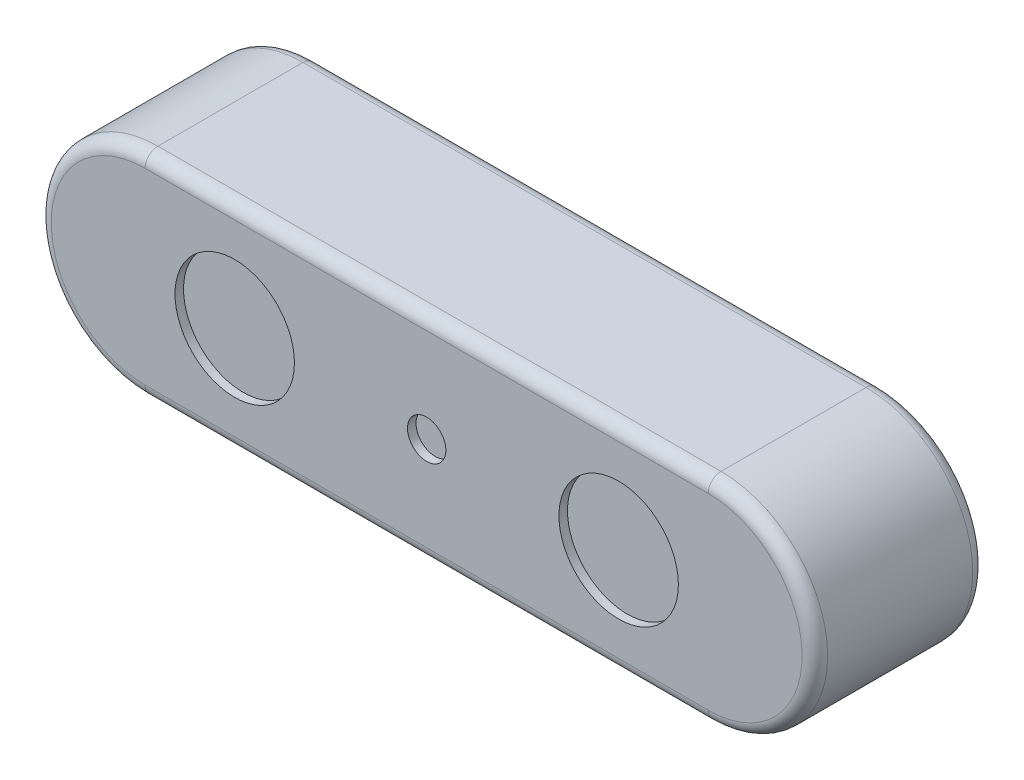
from build123d import *

# Parameters (mm, degrees)
BOSS_EXTRUDE1_DEPTH = 20
FILLET1_R           = 1.5
SKETCH2_R           = 7
SKETCH2_R_2         = 2.25
CUT_EXTRUDE1_DEPTH  = 1
SKETCH3_R           = 1.5
CUT_EXTRUDE2_DEPTH  = 3


with BuildPart() as part:
    # Sketch1 → Boss-Extrude1 (new body)
    with BuildSketch(Plane.XY):
        with BuildLine():
            Line((-33, 12.5), (33, 12.5))
            ThreePointArc((33, 12.5), (45.5, 0), (33, -12.5))
            Line((33, -12.5), (-33, -12.5))
            ThreePointArc((-33, -12.5), (-45.5, 0), (-33, 12.5))
        make_face()
    extrude(amount=BOSS_EXTRUDE1_DEPTH)

    # Fillet1
    fillet1_edges = [part.edges().sort_by_distance(p)[0] for p in [
        (-45.5, 0, 20),
        (0, -12.5, 20),
        (45.5, 0, 20),
        (0, -12.5, 0),
        (-45.5, 0, 0),
        (0, 12.5, 0),
        (45.5, 0, 0),
        (0, 12.5, 20),
    ]]
    fillet(fillet1_edges, radius=FILLET1_R)

    # Sketch2 → Cut-Extrude1 (cut)
    with BuildSketch(Plane.XY.offset(20)):
        with Locations((-22.5, 0)):
            Circle(SKETCH2_R)
        with Locations((22.5, 0)):
            Circle(SKETCH2_R)
        Circle(SKETCH2_R_2)
    extrude(amount=-CUT_EXTRUDE1_DEPTH, mode=Mode.SUBTRACT)

    # Sketch3 → Cut-Extrude2 (cut)
    with BuildSketch(Plane.XZ.offset(12.5)):
        with Locations(Location((-17.5, 10, 0), (0, 0, 270))):
            Circle(SKETCH3_R)
        with Locations(Location((16.5, 10, 0), (0, 0, 90))):
            Circle(SKETCH3_R)
    extrude(amount=-CUT_EXTRUDE2_DEPTH, mode=Mode.SUBTRACT)


solid = part.part
